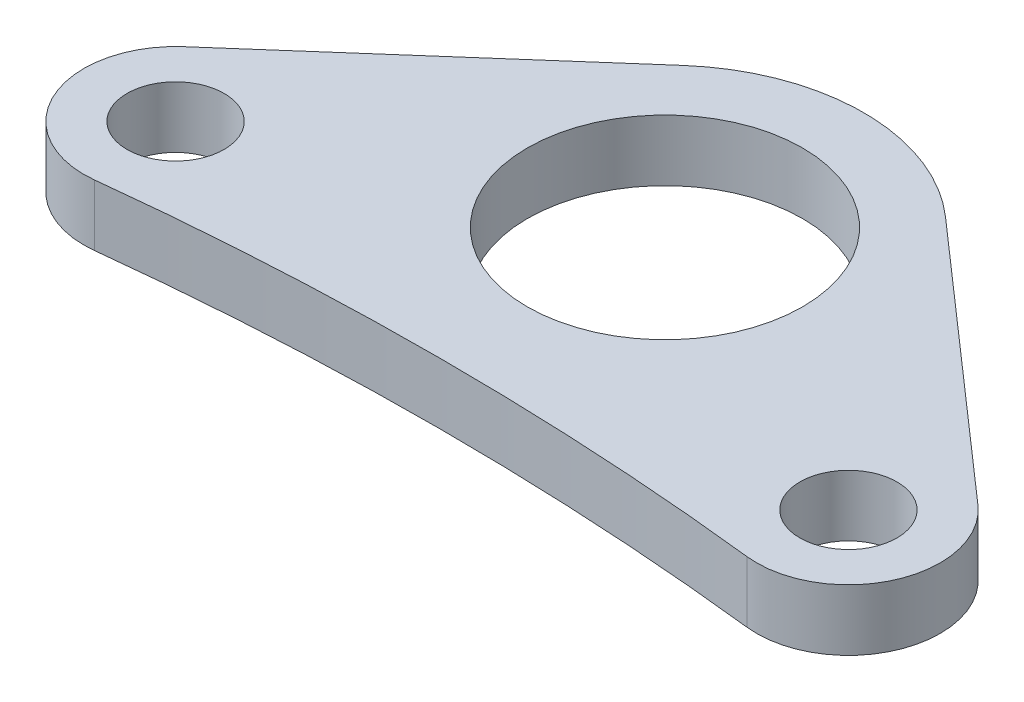
from build123d import *

# Parameters (mm, degrees)
SKETCH1_R               = 14.2875
BOSS_EXTRUDE1_DEPTH     = 6.35
F_3_8_CLEARANCE_HOLE1_D = 10.0838


with BuildPart() as part:
    # Sketch1 → Boss-Extrude1 (new body)
    with BuildSketch(Plane(origin=(0, 0, 0), x_dir=(1, 0, 0), z_dir=(0, 1, 0))):
        with BuildLine():
            Line((-41.209227539, -8.717199414), (-13.615826335, 15.508567937))
            ThreePointArc((-13.615826335, 15.508567937), (0, 20.6375), (13.615826335, 15.508567937))
            Line((13.615826335, 15.508567937), (41.209227539, -8.717199414))
            ThreePointArc((41.209227539, -8.717199414), (43.636188178, -19.727379203), (33.858044807, -25.340053176))
            ThreePointArc((33.858044807, -25.340053176), (0, -23.437740611), (-33.858044807, -25.340053176))
            ThreePointArc((-33.858044807, -25.340053176), (-43.636188178, -19.727379203), (-41.209227539, -8.717199414))
        make_face()
        with Locations(Location((0, 0, 0), (0, 0, 270))):
            Circle(SKETCH1_R, mode=Mode.SUBTRACT)
    extrude(amount=BOSS_EXTRUDE1_DEPTH)

    # 3/8 Clearance Hole1 (through all)
    with Locations(Plane(origin=(0, 6.35, 0), x_dir=(1, 0, 0), z_dir=(0, 1, 0))):
        with Locations((-34.925, -15.875), (34.925, -15.875)):
            Hole(F_3_8_CLEARANCE_HOLE1_D / 2)


solid = part.part
